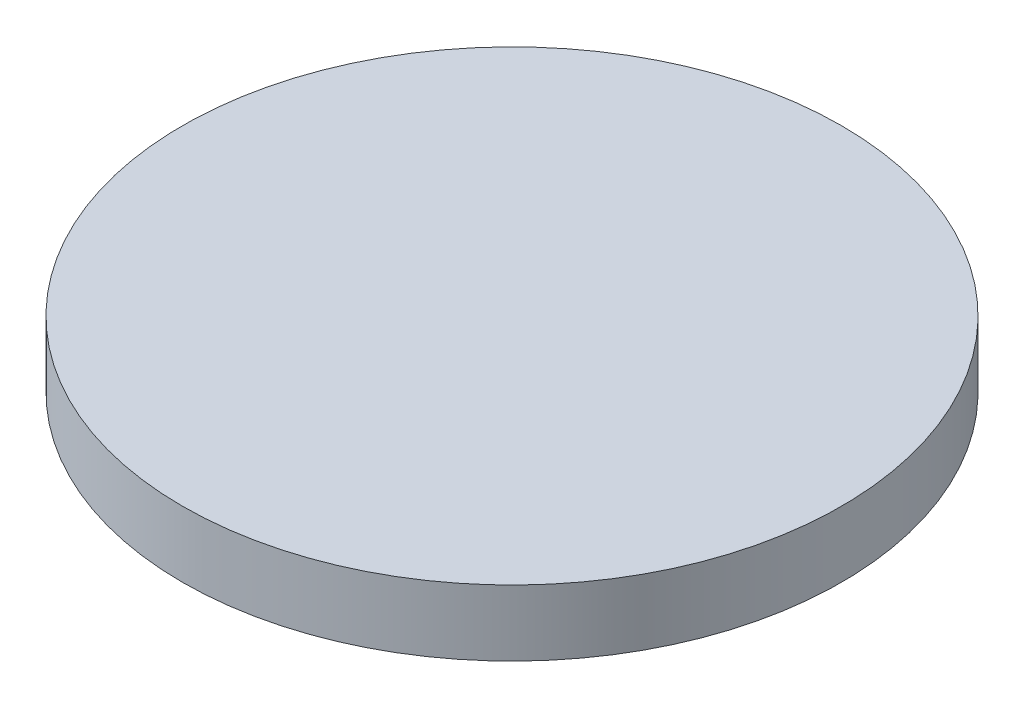
from build123d import *

# Parameters (mm, degrees)
SKETCH1_R           = 63.5
BOSS_EXTRUDE1_DEPTH = 12.7


with BuildPart() as part:
    # Sketch1 → Boss-Extrude1 (new body)
    with BuildSketch(Plane(origin=(0, 0, 0), x_dir=(1, 0, 0), z_dir=(0, 1, 0))):
        with Locations(Location((0, 0, 0), (0, 0, 270))):
            Circle(SKETCH1_R)
    extrude(amount=BOSS_EXTRUDE1_DEPTH)


solid = part.part
